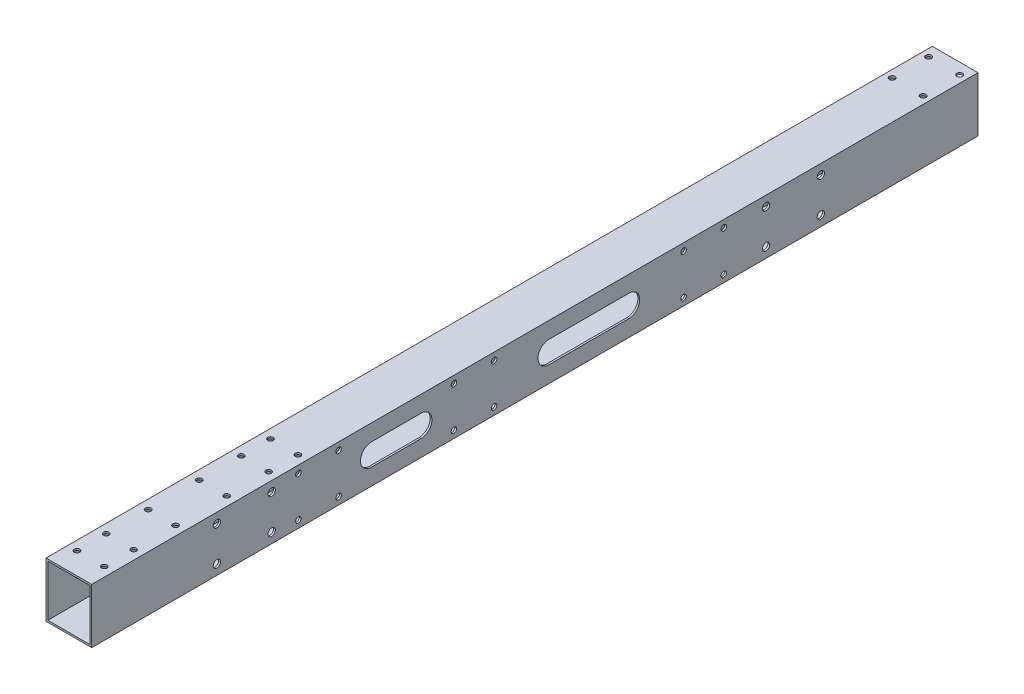
from build123d import *

# Parameters (mm, degrees)
SKETCH_1_W           = 25
SKETCH_1_H           = 30
SKETCH_1_W_2         = 23
SKETCH_1_H_2         = 28
EXTRUDE_1_DEPTH      = 242.5
SKETCH_4_R           = 1.5
CUT_EXTRUDE_3_DEPTH  = 5
SKETCH_5_R           = 1.525
CUT_EXTRUDE_4_DEPTH  = 80
SKETCH_8_R           = 1.55
CUT_EXTRUDE_5_DEPTH  = 59
SKETCH_9_R           = 1.505
CUT_EXTRUDE_6_DEPTH  = 51
CUT_EXTRUDE_7_DEPTH  = 146
SKETCH_11_R          = 2
CUT_EXTRUDE_8_DEPTH  = 39.5
CUT_EXTRUDE_11_REACH = 246.246
SKETCH_13_R          = 2


with BuildPart() as part:
    # 草图1 → 凸台-拉伸1 (new, symmetric)
    with BuildSketch(Plane.XY):
        Rectangle(SKETCH_1_W, SKETCH_1_H)
        Rectangle(SKETCH_1_W_2, SKETCH_1_H_2, mode=Mode.SUBTRACT)
    extrude(amount=EXTRUDE_1_DEPTH, both=True)

    # 草图4 → 切除-拉伸3 (cut, symmetric)
    with BuildSketch(Plane.XZ.offset(-14)):
        with Locations((7.5, 214.55)):
            Circle(SKETCH_4_R)
        with Locations((-7.5, 214.55)):
            Circle(SKETCH_4_R)
        with Locations((7.5, 230.55)):
            Circle(SKETCH_4_R)
        with Locations((-7.5, 230.55)):
            Circle(SKETCH_4_R)
        with Locations((7.5, 124.65)):
            Circle(SKETCH_4_R)
        with Locations((7.5, 140.65)):
            Circle(SKETCH_4_R)
        with Locations((-7.5, 140.65)):
            Circle(SKETCH_4_R)
        with Locations((-7.5, 124.65)):
            Circle(SKETCH_4_R)
    extrude(amount=CUT_EXTRUDE_3_DEPTH, both=True, mode=Mode.SUBTRACT)

    # 草图5 → 切除-拉伸4 (cut, symmetric)
    with BuildSketch(Plane(origin=(0, 15, 0), x_dir=(1, 0, 0), z_dir=(0, 1, 0))):
        with Locations((-7.5, -163.6)):
            Circle(SKETCH_5_R)
        with Locations((7.5, -163.6)):
            Circle(SKETCH_5_R)
        with Locations((-7.5, -191.6)):
            Circle(SKETCH_5_R)
        with Locations((7.5, -191.6)):
            Circle(SKETCH_5_R)
    extrude(amount=CUT_EXTRUDE_4_DEPTH, both=True, mode=Mode.SUBTRACT)

    # 草图8 → 切除-拉伸5 (cut)
    with BuildSketch(Plane(origin=(0, 15, 0), x_dir=(1, 0, 0), z_dir=(0, 1, 0))):
        with Locations(Location((8.5, 236.5, 0), (0, 0, 270))):
            Circle(SKETCH_8_R)
        with Locations(Location((-8.5, 236.5, 0), (0, 0, 270))):
            Circle(SKETCH_8_R)
        with Locations(Location((-8.5, 216.5, 0), (0, 0, 270))):
            Circle(SKETCH_8_R)
        with Locations(Location((8.5, 216.5, 0), (0, 0, 270))):
            Circle(SKETCH_8_R)
    extrude(amount=-CUT_EXTRUDE_5_DEPTH, mode=Mode.SUBTRACT)

    # 草图9 → 切除-拉伸6 (cut)
    with BuildSketch(Plane(origin=(12.5, 0, 0), x_dir=(0, 0, -1), z_dir=(1, 0, 0))):
        with Locations((103.4, -11)):
            Circle(SKETCH_9_R)
        with Locations((103.4, 11)):
            Circle(SKETCH_9_R)
        with Locations((81.4, 11)):
            Circle(SKETCH_9_R)
        with Locations((81.4, -11)):
            Circle(SKETCH_9_R)
        with Locations((-44.295, -11)):
            Circle(SKETCH_9_R)
        with Locations((-44.295, 11)):
            Circle(SKETCH_9_R)
        with Locations((-22.295, 11)):
            Circle(SKETCH_9_R)
        with Locations((-22.295, -11)):
            Circle(SKETCH_9_R)
        with Locations((-107.4, -11)):
            Circle(SKETCH_9_R)
        with Locations((-129.4, -11)):
            Circle(SKETCH_9_R)
        with Locations((-107.4, 11)):
            Circle(SKETCH_9_R)
        with Locations((-129.4, 11)):
            Circle(SKETCH_9_R)
    extrude(amount=-CUT_EXTRUDE_6_DEPTH, mode=Mode.SUBTRACT)

    # 草图10 → 切除-拉伸7 (cut)
    with BuildSketch(Plane.ZY.offset(12.5)):
        with BuildLine():
            Line((-51.4, 6), (-7.705, 6))
            ThreePointArc((-7.705, 6), (-1.705, 0), (-7.705, -6))
            Line((-7.705, -6), (-51.4, -6))
            ThreePointArc((-51.4, -6), (-57.4, 0), (-51.4, 6))
        make_face()
        with BuildLine():
            Line((62.295, 6), (89.4, 6))
            ThreePointArc((89.4, 6), (95.4, 0), (89.4, -6))
            Line((89.4, -6), (62.295, -6))
            ThreePointArc((62.295, -6), (56.295, 0), (62.295, 6))
        make_face()
    extrude(amount=-CUT_EXTRUDE_7_DEPTH, mode=Mode.SUBTRACT)

    # 草图11 → 切除-拉伸8 (cut, symmetric)
    with BuildSketch(Plane(origin=(12.5, 0, 0), x_dir=(0, 0, -1), z_dir=(1, 0, 0))):
        with Locations((156.5, 9.5)):
            Circle(SKETCH_11_R)
        with Locations((126.5, 9.5)):
            Circle(SKETCH_11_R)
        with Locations((126.5, -9.5)):
            Circle(SKETCH_11_R)
        with Locations((156.5, -9.5)):
            Circle(SKETCH_11_R)
    extrude(amount=CUT_EXTRUDE_8_DEPTH, both=True, mode=Mode.SUBTRACT)

    # 切除-拉伸11: up to this face of the body (flat: up to its plane)
    cut_extrude_11_end = Plane(part.part.faces().sort_by_distance((-12.5, 0, -0.673656222))[0])
    # 草图13 → 切除-拉伸11 (cut, up to the picked face)
    with BuildSketch(Plane(origin=(12.5, 0, 0), x_dir=(0, 0, -1), z_dir=(1, 0, 0)), mode=Mode.PRIVATE) as cut_extrude_11_sk1:
        with Locations((-144, -9.5)):
            Circle(SKETCH_13_R)
    cut_extrude_11_tool1 = split(extrude(cut_extrude_11_sk1.sketch, amount=-CUT_EXTRUDE_11_REACH, mode=Mode.PRIVATE), bisect_by=cut_extrude_11_end, keep=Keep.BOTH, mode=Mode.PRIVATE)
    # 草图13 → 切除-拉伸11 (cut, up to the picked face)
    with BuildSketch(Plane(origin=(12.5, 0, 0), x_dir=(0, 0, -1), z_dir=(1, 0, 0)), mode=Mode.PRIVATE) as cut_extrude_11_sk2:
        with Locations((-144, 9.5)):
            Circle(SKETCH_13_R)
    cut_extrude_11_tool2 = split(extrude(cut_extrude_11_sk2.sketch, amount=-CUT_EXTRUDE_11_REACH, mode=Mode.PRIVATE), bisect_by=cut_extrude_11_end, keep=Keep.BOTH, mode=Mode.PRIVATE)
    # 草图13 → 切除-拉伸11 (cut, up to the picked face)
    with BuildSketch(Plane(origin=(12.5, 0, 0), x_dir=(0, 0, -1), z_dir=(1, 0, 0)), mode=Mode.PRIVATE) as cut_extrude_11_sk3:
        with Locations((-174, -9.5)):
            Circle(SKETCH_13_R)
    cut_extrude_11_tool3 = split(extrude(cut_extrude_11_sk3.sketch, amount=-CUT_EXTRUDE_11_REACH, mode=Mode.PRIVATE), bisect_by=cut_extrude_11_end, keep=Keep.BOTH, mode=Mode.PRIVATE)
    # 草图13 → 切除-拉伸11 (cut, up to the picked face)
    with BuildSketch(Plane(origin=(12.5, 0, 0), x_dir=(0, 0, -1), z_dir=(1, 0, 0)), mode=Mode.PRIVATE) as cut_extrude_11_sk4:
        with Locations((-174, 9.5)):
            Circle(SKETCH_13_R)
    cut_extrude_11_tool4 = split(extrude(cut_extrude_11_sk4.sketch, amount=-CUT_EXTRUDE_11_REACH, mode=Mode.PRIVATE), bisect_by=cut_extrude_11_end, keep=Keep.BOTH, mode=Mode.PRIVATE)
    add(cut_extrude_11_tool1.solids().sort_by(Axis((12.5, -9.5, 144), (-1, 0, 0)))[0], mode=Mode.SUBTRACT)
    add(cut_extrude_11_tool2.solids().sort_by(Axis((12.5, 9.5, 144), (-1, 0, 0)))[0], mode=Mode.SUBTRACT)
    add(cut_extrude_11_tool3.solids().sort_by(Axis((12.5, -9.5, 174), (-1, 0, 0)))[0], mode=Mode.SUBTRACT)
    add(cut_extrude_11_tool4.solids().sort_by(Axis((12.5, 9.5, 174), (-1, 0, 0)))[0], mode=Mode.SUBTRACT)


solid = part.part
